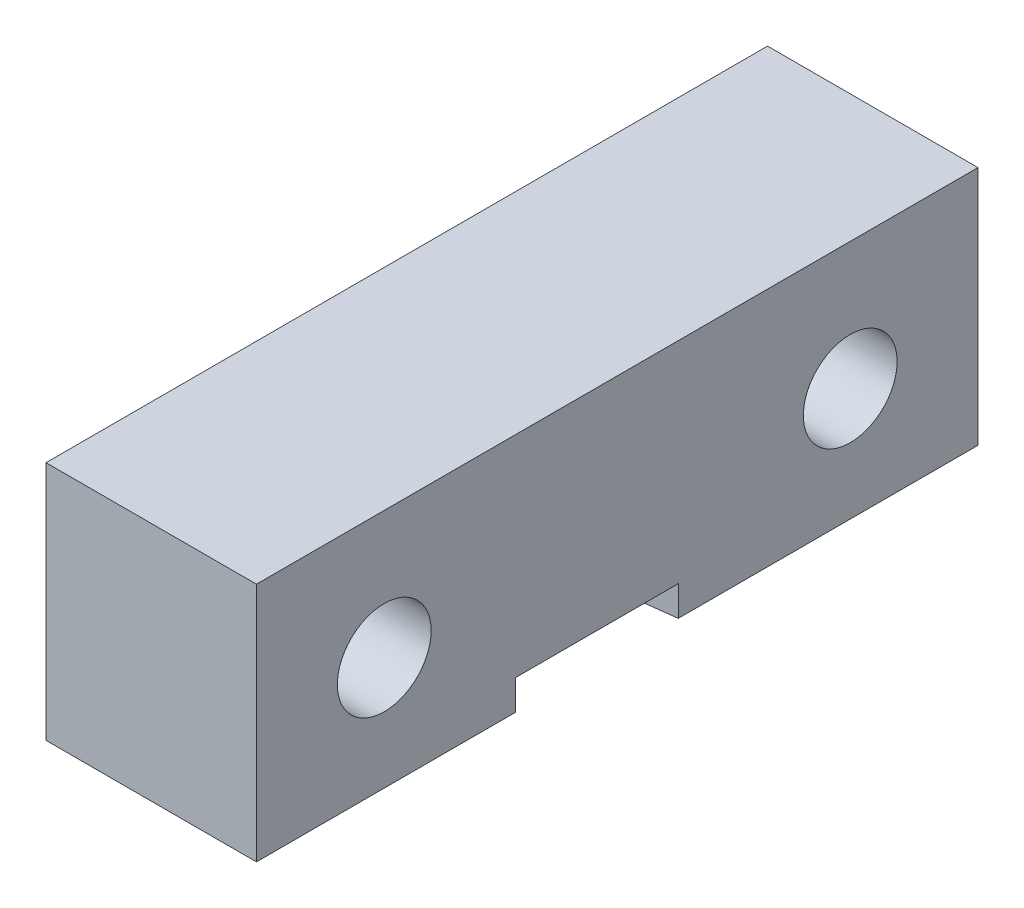
from build123d import *

# Parameters (mm, degrees)
SKETCH1_W           = 44.45
SKETCH1_H           = 50.8
BOSS_EXTRUDE1_DEPTH = 76.2
CUT_EXTRUDE1_REACH  = 93.801
SKETCH2_R           = 6.731
SKETCH3_R           = 9.906
CUT_EXTRUDE2_DEPTH  = 38.608
CUT_EXTRUDE3_DEPTH  = 6.35
SKETCH5_R           = 12.0142
CUT_EXTRUDE4_DEPTH  = 3.81
SKETCH6_R           = 14.6812
CUT_EXTRUDE5_DEPTH  = 1.5875


with BuildPart() as part:
    # Sketch1 → Boss-Extrude1 (new, symmetric)
    with BuildSketch(Plane.XY):
        Rectangle(SKETCH1_W, SKETCH1_H)
    extrude(amount=BOSS_EXTRUDE1_DEPTH, both=True)

    # Sketch2 → Cut-Extrude1 (cut, up to next)
    with BuildSketch(Plane(origin=(22.225, 0, 0), x_dir=(0, 0, -1), z_dir=(1, 0, 0)), mode=Mode.PRIVATE) as cut_extrude1_sk1:
        with Locations((-49.2125, -1.524)):
            Circle(SKETCH2_R)
    cut_extrude1_tool1 = extrude(cut_extrude1_sk1.sketch, amount=-CUT_EXTRUDE1_REACH, mode=Mode.PRIVATE) & part.part
    # Sketch2 → Cut-Extrude1 (cut, up to next)
    with BuildSketch(Plane(origin=(22.225, 0, 0), x_dir=(0, 0, -1), z_dir=(1, 0, 0)), mode=Mode.PRIVATE) as cut_extrude1_sk2:
        with Locations((49.2125, -1.524)):
            Circle(SKETCH2_R)
    cut_extrude1_tool2 = extrude(cut_extrude1_sk2.sketch, amount=-CUT_EXTRUDE1_REACH, mode=Mode.PRIVATE) & part.part
    add(cut_extrude1_tool1.solids().sort_by_distance((22.225, -1.524, 49.2125))[0], mode=Mode.SUBTRACT)
    add(cut_extrude1_tool2.solids().sort_by_distance((22.225, -1.524, -49.2125))[0], mode=Mode.SUBTRACT)

    # Sketch3 → Cut-Extrude2 (cut)
    with BuildSketch(Plane(origin=(22.225, 0, 0), x_dir=(0, 0, -1), z_dir=(1, 0, 0))):
        with Locations((-49.2125, -1.524)):
            Circle(SKETCH3_R)
        with Locations((49.2125, -1.524)):
            Circle(SKETCH3_R)
    extrude(amount=-CUT_EXTRUDE2_DEPTH, mode=Mode.SUBTRACT)

    # Sketch4 → Cut-Extrude3 (cut)
    with BuildSketch(Plane.XZ.offset(25.4)):
        with BuildLine():
            Line((22.225, -12.890241244), (22.225, 21.531765175))
            Line((22.225, 21.531765175), (0.947246364, 18.89010908))
            ThreePointArc((0.947246364, 18.89010908), (-11.925153457, 4.320761965), (0.947246364, -10.248585149))
            Line((0.947246364, -10.248585149), (22.225, -12.890241244))
        make_face()
    extrude(amount=-CUT_EXTRUDE3_DEPTH, mode=Mode.SUBTRACT)

    # Sketch5 → Cut-Extrude4 (cut)
    with BuildSketch(Plane.XZ.offset(19.05)):
        with Locations((2.756046543, 4.320761965)):
            Circle(SKETCH5_R)
    extrude(amount=-CUT_EXTRUDE4_DEPTH, mode=Mode.SUBTRACT)

    # Sketch6 → Cut-Extrude5 (cut)
    with BuildSketch(Plane.XZ.offset(19.05)):
        with Locations((2.756046543, 4.320761965)):
            Circle(SKETCH6_R)
    extrude(amount=-CUT_EXTRUDE5_DEPTH, mode=Mode.SUBTRACT)


solid = part.part
